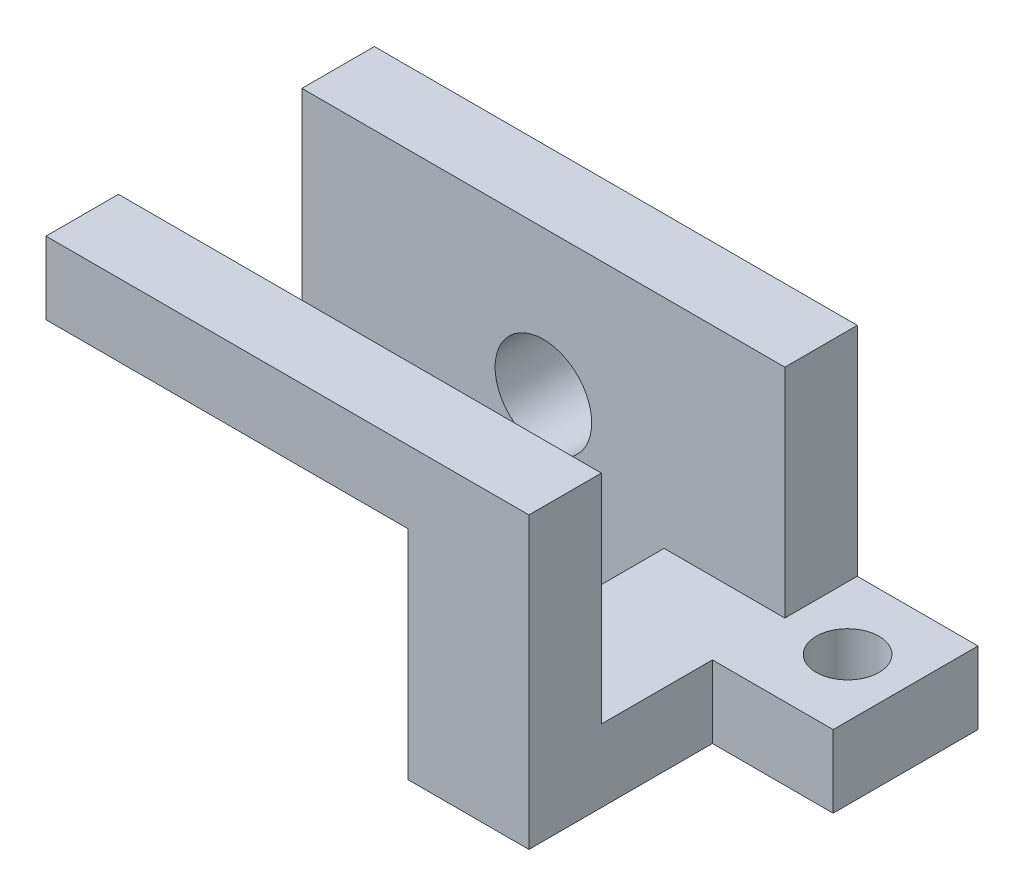
from build123d import *

# Parameters (mm, degrees)
SKETCH1_W           = 100
SKETCH1_H           = 15
BOSS_EXTRUDE1_DEPTH = 60
SKETCH1_6_R         = 6.5
BOSS_EXTRUDE2_DEPTH = 15
SKETCH1_7_W         = 25
SKETCH1_7_H         = 15
BOSS_EXTRUDE3_DEPTH = 60
BOSS_EXTRUDE4_START = 60
SKETCH1_8_W         = 75
SKETCH1_8_H         = 15
BOSS_EXTRUDE4_DEPTH = 15
SKETCH2_R           = 10
CUT_EXTRUDE1_DEPTH  = 15


with BuildPart() as part:
    # Sketch1 → Boss-Extrude1 (new body)
    with BuildSketch(Plane(origin=(0, 0, 0), x_dir=(1, 0, 0), z_dir=(0, 1, 0))):
        with Locations((0, 7.5)):
            Rectangle(SKETCH1_W, SKETCH1_H)
    extrude(amount=BOSS_EXTRUDE1_DEPTH)

    # Sketch1<6> → Boss-Extrude2 (add)
    with BuildSketch(Plane(origin=(0, 0, 0), x_dir=(1, 0, 0), z_dir=(0, 1, 0))):
        Polygon((50, 0), (25, 0), (25, -53), (50, -53), (50, -15), (75, -15), (75, 15), (50, 15), align=None)
        with Locations(Location((63, 0, 0), (0, 0, 270))):
            Circle(SKETCH1_6_R, mode=Mode.SUBTRACT)
    extrude(amount=BOSS_EXTRUDE2_DEPTH)

    # Sketch1<7> → Boss-Extrude3 (add)
    with BuildSketch(Plane(origin=(0, 0, 0), x_dir=(1, 0, 0), z_dir=(0, 1, 0))):
        with Locations((37.5, -45.5)):
            Rectangle(SKETCH1_7_W, SKETCH1_7_H)
    extrude(amount=BOSS_EXTRUDE3_DEPTH)

    # Sketch1<8> → Boss-Extrude4 (add)
    with BuildSketch(Plane(origin=(0, 0, 0), x_dir=(1, 0, 0), z_dir=(0, 1, 0)).offset(BOSS_EXTRUDE4_START)):
        with Locations((-12.5, -45.5)):
            Rectangle(SKETCH1_8_W, SKETCH1_8_H)
    extrude(amount=-BOSS_EXTRUDE4_DEPTH)

    # Sketch2 → Cut-Extrude1 (cut)
    with BuildSketch(Plane.XY):
        with Locations((0, 30)):
            Circle(SKETCH2_R)
    extrude(amount=-CUT_EXTRUDE1_DEPTH, mode=Mode.SUBTRACT)


solid = part.part
